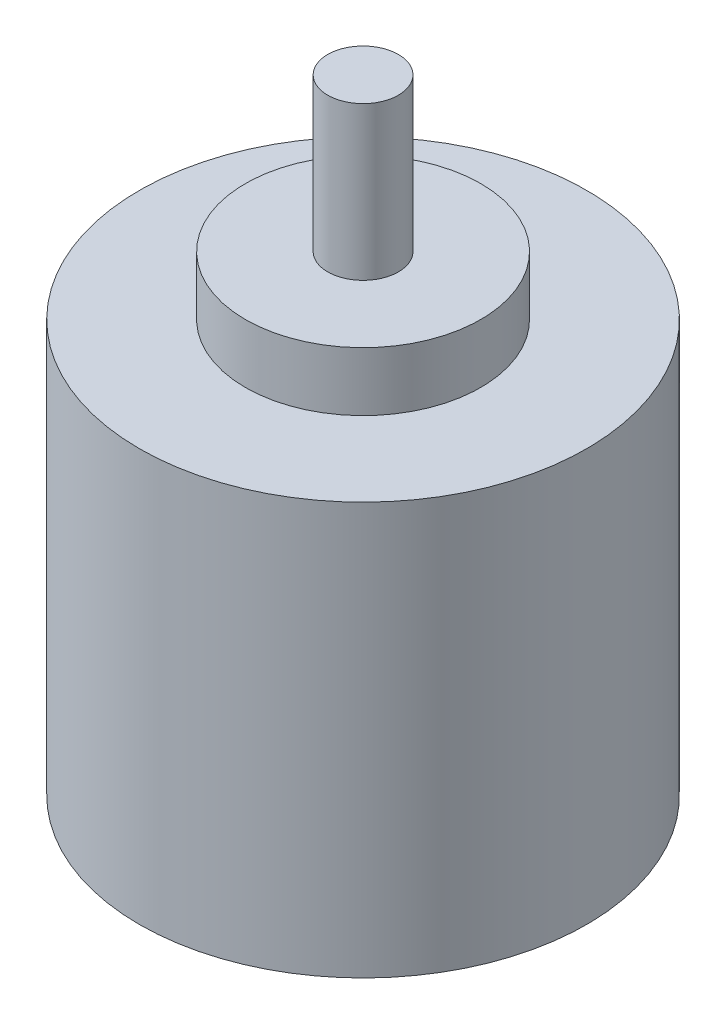
from build123d import *

# Parameters (mm, degrees)
SKETCH1_R           = 19
BOSS_EXTRUDE1_DEPTH = 35
SKETCH2_R           = 10
BOSS_EXTRUDE2_DEPTH = 5
SKETCH3_R           = 3
BOSS_EXTRUDE3_DEPTH = 13


with BuildPart() as part:
    # Sketch1 → Boss-Extrude1 (new body)
    with BuildSketch(Plane(origin=(0, 0, 0), x_dir=(1, 0, 0), z_dir=(0, 1, 0))):
        with Locations(Location((0, 0, 0), (0, 0, 270))):
            Circle(SKETCH1_R)
    extrude(amount=BOSS_EXTRUDE1_DEPTH)

    # Sketch2 → Boss-Extrude2 (add)
    with BuildSketch(Plane(origin=(0, 35, 0), x_dir=(1, 0, 0), z_dir=(0, 1, 0))):
        with Locations(Location((0, 0, 0), (0, 0, 270))):
            Circle(SKETCH2_R)
    extrude(amount=BOSS_EXTRUDE2_DEPTH)

    # Sketch3 → Boss-Extrude3 (add)
    with BuildSketch(Plane(origin=(0, 40, 0), x_dir=(1, 0, 0), z_dir=(0, 1, 0))):
        with Locations(Location((0, 0, 0), (0, 0, 90))):
            Circle(SKETCH3_R)
    extrude(amount=BOSS_EXTRUDE3_DEPTH)


solid = part.part
